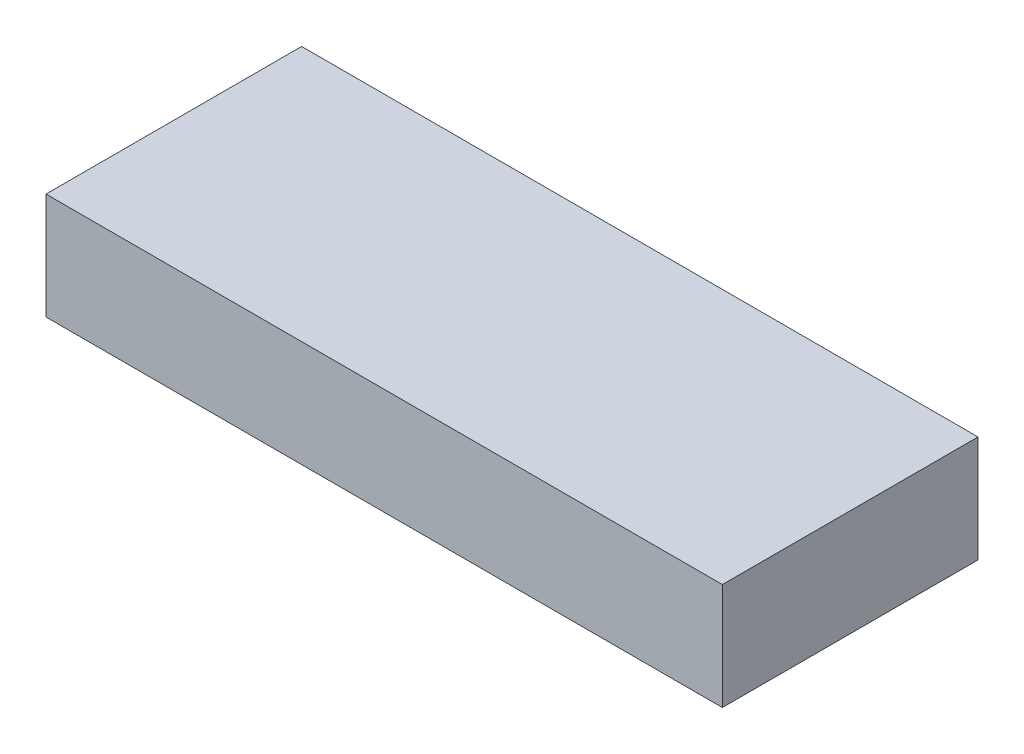
from build123d import *

# Parameters (mm, degrees)
SKETCH_1_W      = 50.8
SKETCH_1_H      = 19.2
EXTRUDE_1_DEPTH = 8


with BuildPart() as part:
    # Эскиз1 → Бобышка-Вытянуть1 (new body)
    with BuildSketch(Plane(origin=(0, 0, 0), x_dir=(1, 0, 0), z_dir=(0, 1, 0))):
        with Locations((25.4, -9.6)):
            Rectangle(SKETCH_1_W, SKETCH_1_H)
    extrude(amount=EXTRUDE_1_DEPTH)


solid = part.part
